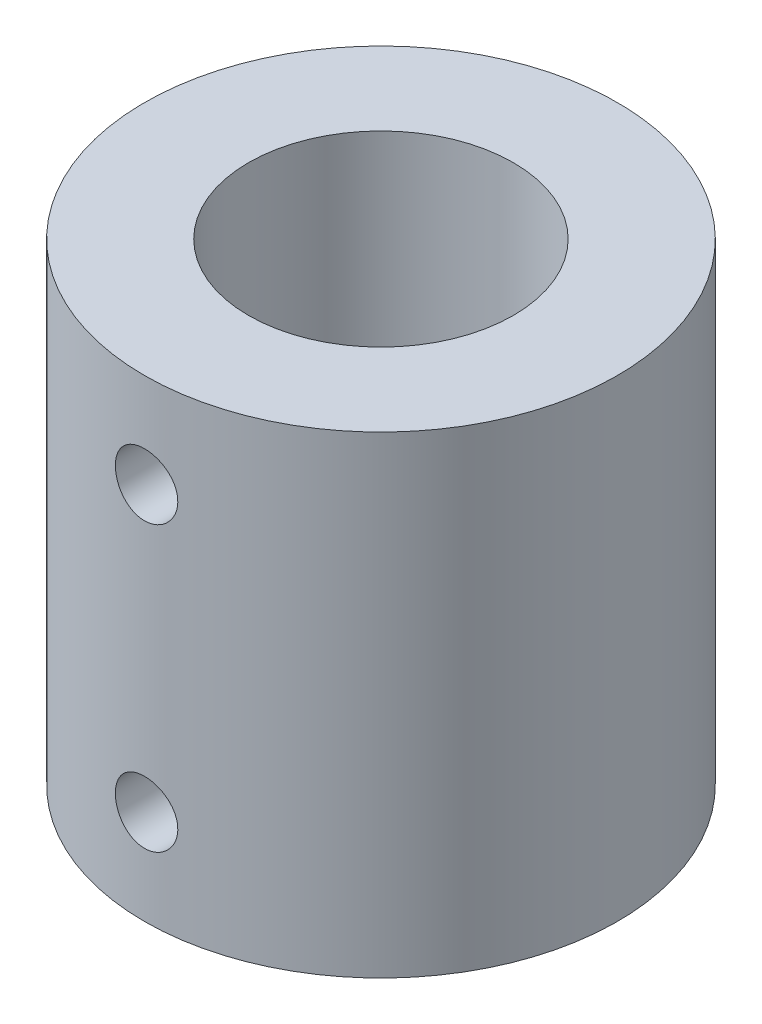
from build123d import *

# Parameters (mm, degrees)
SKETCH1_R           = 12.5
SKETCH1_R_2         = 3
BOSS_EXTRUDE1_DEPTH = 25
SKETCH2_R           = 7
CUT_EXTRUDE1_DEPTH  = 12.5
SKETCH3_R           = 1.65
CUT_EXTRUDE2_DEPTH  = 31.618621785


with BuildPart() as part:
    # Sketch1 → Boss-Extrude1 (new body)
    with BuildSketch(Plane(origin=(0, 0, 0), x_dir=(1, 0, 0), z_dir=(0, 1, 0))):
        with Locations(Location((0, 0, 0), (0, 0, 270))):
            Circle(SKETCH1_R)
        with Locations(Location((0, 0, 0), (0, 0, 270))):
            Circle(SKETCH1_R_2, mode=Mode.SUBTRACT)
    extrude(amount=BOSS_EXTRUDE1_DEPTH)

    # Sketch2 → Cut-Extrude1 (cut)
    with BuildSketch(Plane(origin=(0, 25, 0), x_dir=(1, 0, 0), z_dir=(0, 1, 0))):
        with Locations(Location((0, 0, 0), (0, 0, 270))):
            Circle(SKETCH2_R)
    extrude(amount=-CUT_EXTRUDE1_DEPTH, mode=Mode.SUBTRACT)

    # Sketch3 → Cut-Extrude2 (cut, through all)
    with BuildSketch(Plane.XY):
        with Locations(Location((0, 5, 0), (0, 0, 90.000000006))):
            Circle(SKETCH3_R)
        with Locations(Location((0, 20, 0), (0, 0, 90))):
            Circle(SKETCH3_R)
    extrude(amount=CUT_EXTRUDE2_DEPTH, mode=Mode.SUBTRACT)


solid = part.part
